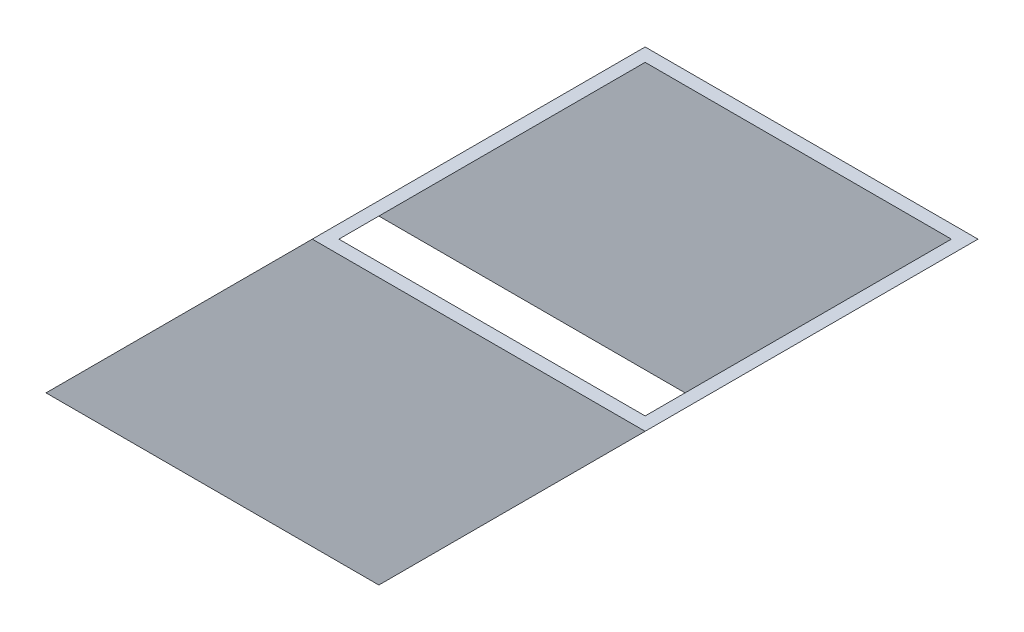
from build123d import *

# Parameters (mm, degrees)
SALIENTE_EXTRUIR1_DEPTH = 2
SALIENTE_EXTRUIR2_DEPTH = 46
SALIENTE_EXTRUIR3_DEPTH = 2
CROQUIS5_R              = 1.5
CORTAR_EXTRUIR1_DEPTH   = 1.414213562
CROQUIS8_W              = 10
CROQUIS8_H              = 5.5
CORTAR_EXTRUIR2_DEPTH   = 1
CORTAR_EXTRUIR2_DRAFT   = -45


with BuildPart() as part:
    # Croquis2 → Saliente-Extruir1 (new body)
    with BuildSketch(Plane.XY):
        Polygon((-42.342007435, -30.353159851), (7.657992565, -30.353159851), (-32.342007435, -70.353159851), (-82.342007435, -70.353159851), align=None)
    extrude(amount=SALIENTE_EXTRUIR1_DEPTH)

    # Croquis3 → Saliente-Extruir2 (add)
    with BuildSketch(Plane(origin=(0, 0, 0), x_dir=(-1, 0, 0), z_dir=(0, 0, -1))):
        Polygon((-5.657992565, -30.353159851), (-7.657992565, -30.353159851), (32.342007435, -70.353159851), (34.342007435, -70.353159851), align=None)
        Polygon((42.342007435, -30.353159851), (40.342007435, -30.353159851), (80.342007435, -70.353159851), (82.342007435, -70.353159851), align=None)
    extrude(amount=SALIENTE_EXTRUIR2_DEPTH)

    # Croquis4 → Saliente-Extruir3 (add)
    with BuildSketch(Plane(origin=(0, 0, -46), x_dir=(-1, 0, 0), z_dir=(0, 0, -1))):
        Polygon((-7.657992565, -30.353159851), (42.342007435, -30.353159851), (82.342007435, -70.353159851), (32.342007435, -70.353159851), align=None)
    extrude(amount=SALIENTE_EXTRUIR3_DEPTH)

    # Croquis5 → Cortar-Extruir1 (cut)
    with BuildSketch(Plane(origin=(-5.994423792, 5.994423792, 0), x_dir=(0, 0, 1), z_dir=(-0.7071067811865438, 0.7071067811865513, 0))):
        with Locations(Location((-24.75, -77.971788243, 0), (0, 0, 270))):
            Circle(CROQUIS5_R)
        with Locations(Location((-21.25, -77.971788243, 0), (0, 0, 270))):
            Circle(CROQUIS5_R)
    extrude(amount=-CORTAR_EXTRUIR1_DEPTH, mode=Mode.SUBTRACT)


with BuildPart() as cortar_extruir2_tool:
    # Croquis8 → Cortar-Extruir2 (with draft: the straight prism first)
    with BuildSketch(Plane(origin=(-5.994423792, 5.994423792, 0), x_dir=(0, 0, 1), z_dir=(-0.7071067811865438, 0.7071067811865513, 0))):
        with Locations((-23, -77.971788243)):
            Rectangle(CROQUIS8_W, CROQUIS8_H)
    extrude(amount=-CORTAR_EXTRUIR2_DEPTH)
    # Cortar-Extruir2: the draft: its side faces are tilted about the plane it starts from
    cortar_extruir2_sides = [cortar_extruir2_tool.faces().sort_by_distance(p)[0] for p in [
        (-62.719794257, -51.438053455, -23),
        (-60.775250609, -49.493509806, -18),
        (-58.83070696, -47.548966158, -23),
        (-60.775250609, -49.493509806, -28),
    ]]
    draft(cortar_extruir2_sides, Plane(origin=(-5.994423792, 5.994423792, 0), x_dir=(0, 0, 1), z_dir=(-0.7071067811865438, 0.7071067811865513, 0)), CORTAR_EXTRUIR2_DRAFT)


with BuildPart() as part_1:
    add(part.part)

    # Cortar-Extruir2: cut by cortar_extruir2_tool
    add(cortar_extruir2_tool.part, mode=Mode.SUBTRACT)


solid = part_1.part
